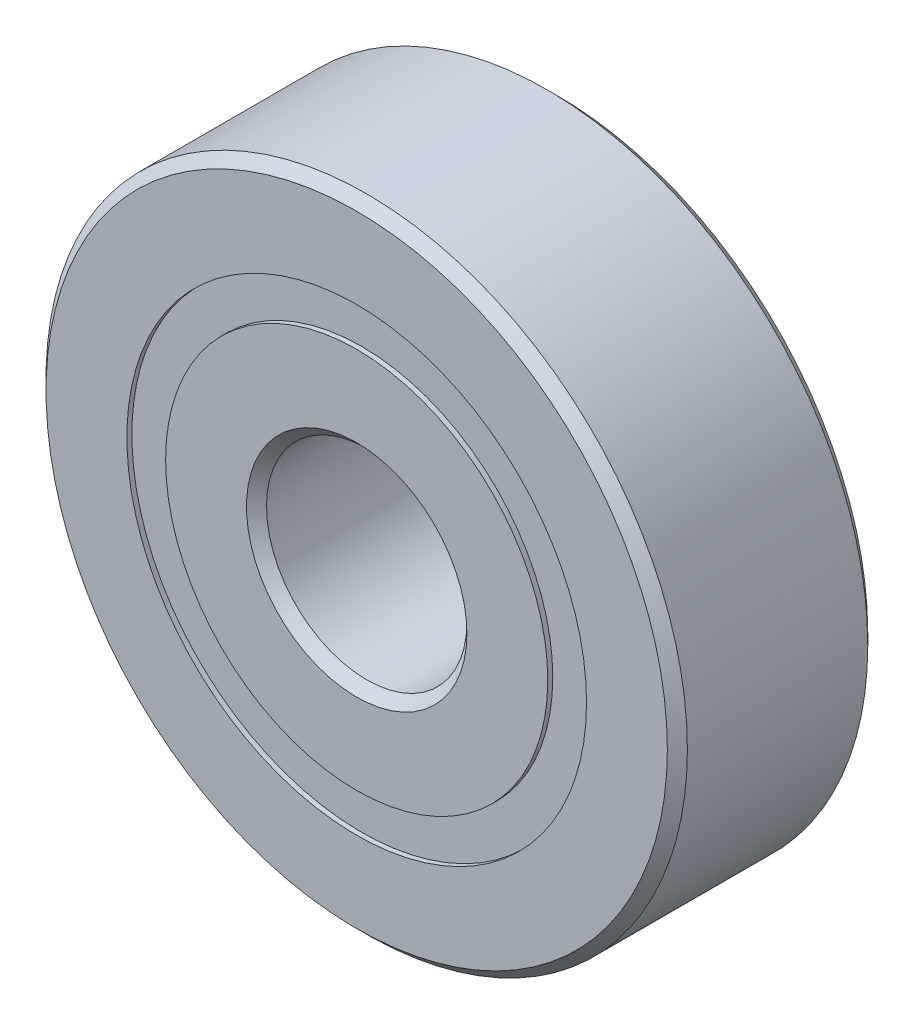
from build123d import *

# Parameters (mm, degrees)
CIRPATTERN1_COUNT = 12
SKETCH5_W         = 1.163242561
SKETCH5_H         = 0.967032968


with BuildPart() as part:
    # Sketch1 → Revolve1 (revolve)
    with BuildSketch(Plane(origin=(0, 0, 0), x_dir=(0, 0, -1), z_dir=(1, 0, 0)), mode=Mode.PRIVATE) as revolve1_sk:
        with BuildLine():
            Line((2.25, 8), (-2.25, 8))
            Line((-2.25, 8), (-2.5, 7.75))
            Line((-2.5, 7.75), (-2.5, 5.733516484))
            Line((-2.5, 5.733516484), (-1.111111111, 5.733516484))
            ThreePointArc((-1.111111111, 5.733516484), (0, 6.461757439), (1.111111111, 5.733516484))
            Line((1.111111111, 5.733516484), (2.5, 5.733516484))
            Line((2.5, 5.733516484), (2.5, 7.75))
            Line((2.5, 7.75), (2.25, 8))
        make_face()
    revolve(revolve1_sk.sketch.rotate(Axis((0, 0, 2.5), (0, 0, -1)), 90), axis=Axis((0, 0, 2.5), (0, 0, -1)))


with BuildPart() as body_2:
    # Sketch3 → Revolve3 (revolve)
    with BuildSketch(Plane(origin=(0, 0, 0), x_dir=(0, 0, -1), z_dir=(1, 0, 0)), mode=Mode.PRIVATE) as revolve3_sk:
        with BuildLine():
            Line((-2.5, 4.766483516), (-1.111111111, 4.766483516))
            ThreePointArc((-1.111111111, 4.766483516), (0, 4.038242561), (1.111111111, 4.766483516))
            Line((1.111111111, 4.766483516), (2.5, 4.766483516))
            Line((2.5, 4.766483516), (2.5, 2.75))
            Line((2.5, 2.75), (2.25, 2.5))
            Line((2.25, 2.5), (-2.25, 2.5))
            Line((-2.25, 2.5), (-2.5, 2.75))
            Line((-2.5, 2.75), (-2.5, 4.766483516))
        make_face()
    revolve(revolve3_sk.sketch.rotate(Axis((0, 0, 2.5), (0, 0, -1)), 90), axis=Axis((0, 0, 2.5), (0, 0, -1)))


with BuildPart() as body_3:
    # Sketch4 → Revolve4 (revolve)
    with BuildSketch(Plane(origin=(0, 0, 0), x_dir=(0, 0, -1), z_dir=(1, 0, 0))):
        with BuildLine():
            Line((-1.211757439, 5.25), (1.211757439, 5.25))
            ThreePointArc((1.211757439, 5.25), (0, 6.461757439), (-1.211757439, 5.25))
        make_face()
    revolve(axis=Axis((0, 5.25, 1.211757439), (0, 0, -1)))


with BuildPart() as cirpattern1_1:
    # CirPattern1: pattern copy
    add(body_3.part.rotate(Axis((0, 0, 0), (0, 0, 1)), 1 * 360 / CIRPATTERN1_COUNT))


with BuildPart() as cirpattern1_2:
    # CirPattern1: pattern copy
    add(body_3.part.rotate(Axis((0, 0, 0), (0, 0, 1)), 2 * 360 / CIRPATTERN1_COUNT))


with BuildPart() as cirpattern1_3:
    # CirPattern1: pattern copy
    add(body_3.part.rotate(Axis((0, 0, 0), (0, 0, 1)), 3 * 360 / CIRPATTERN1_COUNT))


with BuildPart() as cirpattern1_4:
    # CirPattern1: pattern copy
    add(body_3.part.rotate(Axis((0, 0, 0), (0, 0, 1)), 4 * 360 / CIRPATTERN1_COUNT))


with BuildPart() as cirpattern1_5:
    # CirPattern1: pattern copy
    add(body_3.part.rotate(Axis((0, 0, 0), (0, 0, 1)), 5 * 360 / CIRPATTERN1_COUNT))


with BuildPart() as cirpattern1_6:
    # CirPattern1: pattern copy
    add(body_3.part.rotate(Axis((0, 0, 0), (0, 0, 1)), 6 * 360 / CIRPATTERN1_COUNT))


with BuildPart() as cirpattern1_7:
    # CirPattern1: pattern copy
    add(body_3.part.rotate(Axis((0, 0, 0), (0, 0, 1)), 7 * 360 / CIRPATTERN1_COUNT))


with BuildPart() as cirpattern1_8:
    # CirPattern1: pattern copy
    add(body_3.part.rotate(Axis((0, 0, 0), (0, 0, 1)), 8 * 360 / CIRPATTERN1_COUNT))


with BuildPart() as cirpattern1_9:
    # CirPattern1: pattern copy
    add(body_3.part.rotate(Axis((0, 0, 0), (0, 0, 1)), 9 * 360 / CIRPATTERN1_COUNT))


with BuildPart() as cirpattern1_10:
    # CirPattern1: pattern copy
    add(body_3.part.rotate(Axis((0, 0, 0), (0, 0, 1)), 10 * 360 / CIRPATTERN1_COUNT))


with BuildPart() as cirpattern1_11:
    # CirPattern1: pattern copy
    add(body_3.part.rotate(Axis((0, 0, 0), (0, 0, 1)), 11 * 360 / CIRPATTERN1_COUNT))


with BuildPart() as body_15:
    # Sketch5 → Revolve5 (revolve)
    with BuildSketch(Plane(origin=(0, 0, 0), x_dir=(0, 0, -1), z_dir=(1, 0, 0)), mode=Mode.PRIVATE) as revolve5_sk:
        with Locations((-1.79337872, 5.25)):
            Rectangle(SKETCH5_W, SKETCH5_H)
        with Locations((1.79337872, 5.25)):
            Rectangle(SKETCH5_W, SKETCH5_H)
    revolve(revolve5_sk.sketch.rotate(Axis((0, 0, 2.5), (0, 0, -1)), 90), axis=Axis((0, 0, 2.5), (0, 0, -1)))


solid = Compound([part.part, body_2.part, body_3.part, cirpattern1_1.part, cirpattern1_2.part, cirpattern1_3.part, cirpattern1_4.part, cirpattern1_5.part, cirpattern1_6.part, cirpattern1_7.part, cirpattern1_8.part, cirpattern1_9.part, cirpattern1_10.part, cirpattern1_11.part, body_15.part])
